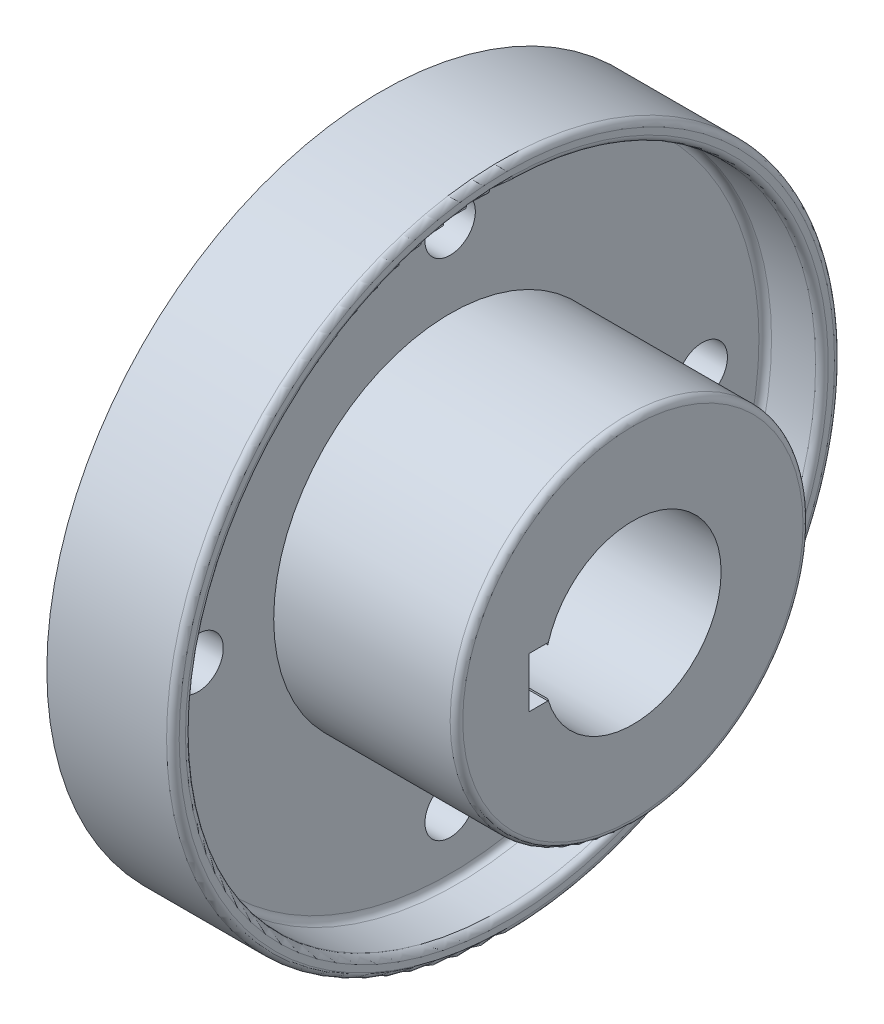
from build123d import *

# Parameters (mm, degrees)
SKETCH2_R          = 28
CUT_EXTRUDE1_DEPTH = 170.917627102
SKETCH3_R          = 46
CUT_EXTRUDE2_DEPTH = 6
SKETCH4_W          = 6
SKETCH4_H          = 16
CUT_EXTRUDE6_DEPTH = 168.176553424
SKETCH5_R          = 8
CUT_EXTRUDE7_DEPTH = 170.917627149
CIRPATTERN1_COUNT  = 4


with BuildPart() as part:
    # Sketch1 → Revolve1 (revolve)
    with BuildSketch(Plane.XY, mode=Mode.PRIVATE) as revolve1_sk:
        with BuildLine():
            Line((0, 0), (80, 0))
            Line((80, 0), (80, 54))
            ThreePointArc((80, 54), (79.414213562, 55.414213562), (78, 56))
            Line((78, 56), (28.292682927, 56))
            Line((28.292682927, 56), (22, 56))
            Line((22, 56), (22, 98))
            ThreePointArc((22, 98), (22.585786438, 99.414213562), (24, 100))
            Line((24, 100), (38, 100))
            ThreePointArc((38, 100), (39.414213562, 100.585786438), (40, 102))
            Line((40, 102), (40, 104))
            ThreePointArc((40, 104), (39.414213562, 105.414213562), (38, 106))
            Line((38, 106), (0, 106))
            Line((0, 106), (0, 0))
        make_face()
    revolve(revolve1_sk.sketch.rotate(Axis((0, 0, 0), (1, 0, 0)), 90), axis=Axis((0, 0, 0), (1, 0, 0)))

    # Sketch2 → Cut-Extrude1 (cut, through all)
    with BuildSketch(Plane(origin=(80, 0, 0), x_dir=(0, 0, -1), z_dir=(1, 0, 0))):
        Circle(SKETCH2_R)
    extrude(amount=-CUT_EXTRUDE1_DEPTH, mode=Mode.SUBTRACT)

    # Sketch3 → Cut-Extrude2 (cut)
    with BuildSketch(Plane.ZY):
        Circle(SKETCH3_R)
    extrude(amount=-CUT_EXTRUDE2_DEPTH, mode=Mode.SUBTRACT)

    # Sketch4 → Cut-Extrude6 (cut, through all)
    with BuildSketch(Plane.ZY.offset(-6)):
        with Locations((30, 0)):
            Rectangle(SKETCH4_W, SKETCH4_H)
    extrude(amount=-CUT_EXTRUDE6_DEPTH, mode=Mode.SUBTRACT)

    # Sketch5 → Cut-Extrude7 (cut, through all)
    with BuildSketch(Plane.ZY):
        with Locations((0, 80)):
            Circle(SKETCH5_R)
    cut_extrude7 = extrude(amount=-CUT_EXTRUDE7_DEPTH, mode=Mode.SUBTRACT)

    # CirPattern1: Cut-Extrude7 ×4 about axis
    cirpattern1_axis = Axis((0, 0, 0), (1, 0, 0))
    for i in range(1, CIRPATTERN1_COUNT):
        add(cut_extrude7.rotate(cirpattern1_axis, i * 360 / CIRPATTERN1_COUNT), mode=Mode.SUBTRACT)


solid = part.part
